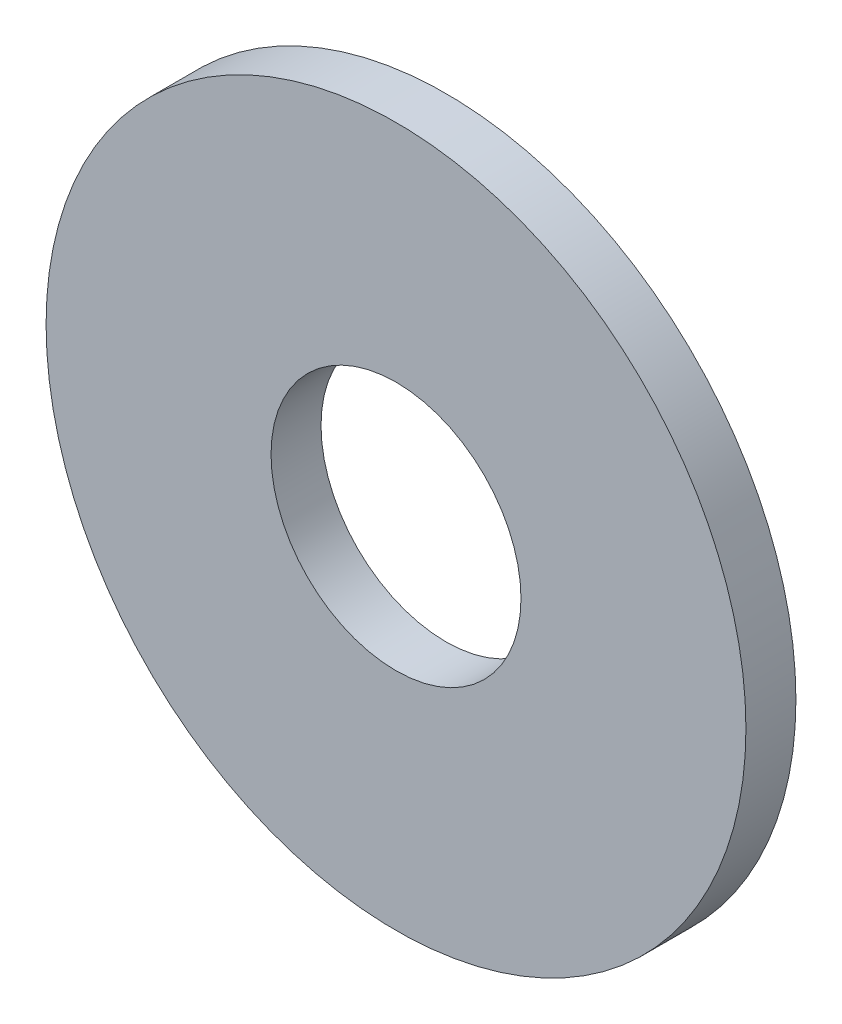
from build123d import *

# Parameters (mm, degrees)
SKETCH1_R           = 14
SKETCH1_R_2         = 5
BOSS_EXTRUDE1_DEPTH = 2


with BuildPart() as part:
    # Sketch1 → Boss-Extrude1 (new body)
    with BuildSketch(Plane.XY):
        Circle(SKETCH1_R)
        Circle(SKETCH1_R_2, mode=Mode.SUBTRACT)
    extrude(amount=BOSS_EXTRUDE1_DEPTH)


solid = part.part
